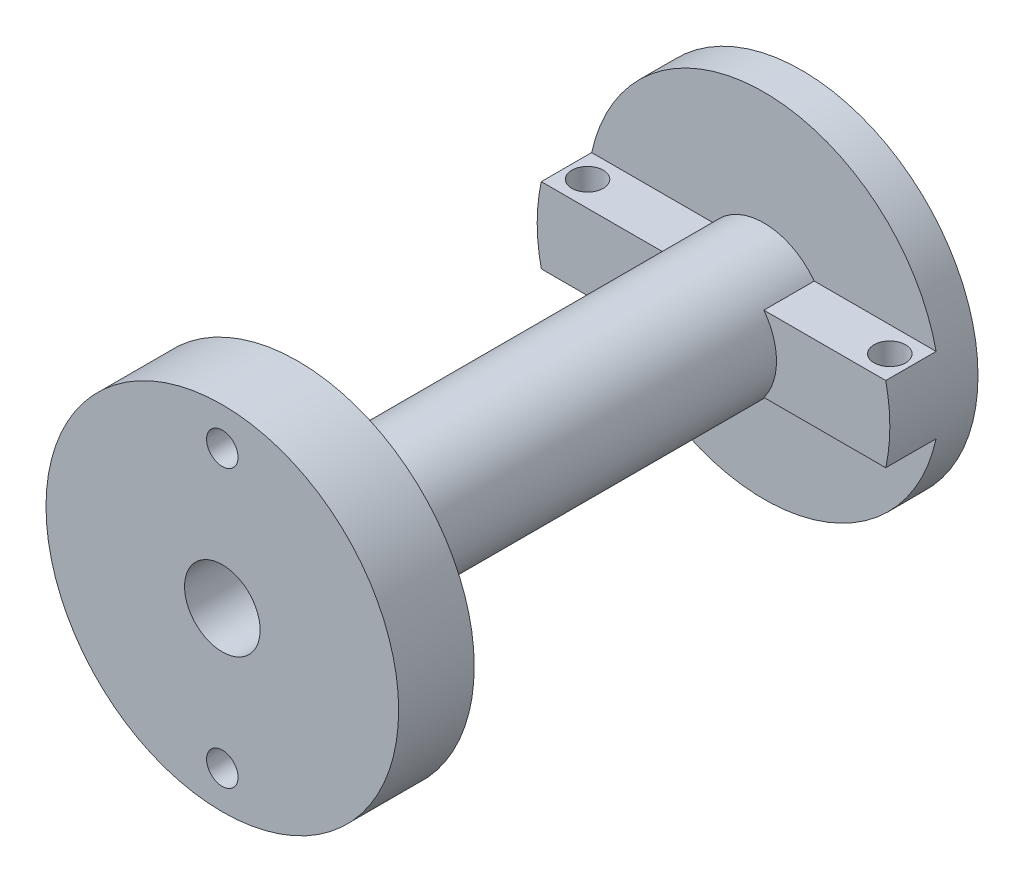
from build123d import *
from build123d.topology import SkipClean

# Parameters (mm, degrees)
SKETCH1_R           = 7
BOSS_EXTRUDE1_DEPTH = 1.5
SKETCH2_R           = 2.5
BOSS_EXTRUDE2_DEPTH = 18.5
SKETCH3_R           = 7
BOSS_EXTRUDE3_DEPTH = 3
CUT_EXTRUDE1_REACH  = 27.04
SKETCH4_R           = 1.5
CUT_EXTRUDE4_REACH  = 27.04
SKETCH5_R           = 0.625
BOSS_EXTRUDE5_DEPTH = 2
CUT_EXTRUDE5_REACH  = 27.5
SKETCH16_R          = 0.625
CUT_EXTRUDE6_REACH  = 25.67
SKETCH17_R          = 1.5


with BuildPart() as part:
    # Sketch1 → Boss-Extrude1 (new body)
    with BuildSketch(Plane.XY):
        Circle(SKETCH1_R)
    extrude(amount=BOSS_EXTRUDE1_DEPTH)

    # Sketch2 → Boss-Extrude2 (add)
    with BuildSketch(Plane.XY.offset(1.5)):
        Circle(SKETCH2_R)
    extrude(amount=BOSS_EXTRUDE2_DEPTH)

    # Sketch3 → Boss-Extrude3 (add)
    with BuildSketch(Plane.XY.offset(20)):
        Circle(SKETCH3_R)
    extrude(amount=BOSS_EXTRUDE3_DEPTH)

    # Sketch4 → Cut-Extrude1 (cut, up to next)
    with BuildSketch(Plane(origin=(0, 0, 0), x_dir=(-1, 0, 0), z_dir=(0, 0, -1)), mode=Mode.PRIVATE) as cut_extrude1_sk1:
        Circle(SKETCH4_R)
    cut_extrude1_tool1 = extrude(cut_extrude1_sk1.sketch, amount=-CUT_EXTRUDE1_REACH, mode=Mode.PRIVATE) & part.part
    add(cut_extrude1_tool1.solids().sort_by_distance((0, 0, 0))[0], mode=Mode.SUBTRACT)

    # Sketch5 → Cut-Extrude4 (cut, up to next)
    with BuildSketch(Plane.XY.offset(23), mode=Mode.PRIVATE) as cut_extrude4_sk1:
        with Locations((0, 5.5)):
            Circle(SKETCH5_R)
    cut_extrude4_tool1 = extrude(cut_extrude4_sk1.sketch, amount=-CUT_EXTRUDE4_REACH, mode=Mode.PRIVATE) & part.part
    # Sketch5 → Cut-Extrude4 (cut, up to next)
    with BuildSketch(Plane.XY.offset(23), mode=Mode.PRIVATE) as cut_extrude4_sk2:
        with Locations((0, -5.5)):
            Circle(SKETCH5_R)
    cut_extrude4_tool2 = extrude(cut_extrude4_sk2.sketch, amount=-CUT_EXTRUDE4_REACH, mode=Mode.PRIVATE) & part.part
    add(cut_extrude4_tool1.solids().sort_by_distance((0, 5.5, 23))[0], mode=Mode.SUBTRACT)
    add(cut_extrude4_tool2.solids().sort_by_distance((0, -5.5, 23))[0], mode=Mode.SUBTRACT)

    # Sketch15 → Boss-Extrude5 (add)
    with SkipClean():  # the faces are left unmerged after this step: merging them gives an invalid solid
        with BuildSketch(Plane.XY.offset(1.5)):
            with BuildLine():
                Line((6.837397, -1.5), (-6.837397, -1.5))
                ThreePointArc((-6.837397, -1.5), (-7, 0), (-6.837397, 1.5))
                Line((-6.837397, 1.5), (6.837397, 1.5))
                ThreePointArc((6.837397, 1.5), (7, 0), (6.837397, -1.5))
            make_face()
        extrude(amount=BOSS_EXTRUDE5_DEPTH)

    # Sketch16 → Cut-Extrude5 (cut, up to next)
    with BuildSketch(Plane.XZ.offset(1.5), mode=Mode.PRIVATE) as cut_extrude5_sk1:
        with Locations((-6, 2.5)):
            Circle(SKETCH16_R)
    cut_extrude5_tool1 = extrude(cut_extrude5_sk1.sketch, amount=-CUT_EXTRUDE5_REACH, mode=Mode.PRIVATE) & part.part
    # Sketch16 → Cut-Extrude5 (cut, up to next)
    with BuildSketch(Plane.XZ.offset(1.5), mode=Mode.PRIVATE) as cut_extrude5_sk2:
        with Locations(Location((6, 2.5, 0), (0, 0, 270))):
            Circle(SKETCH16_R)
    cut_extrude5_tool2 = extrude(cut_extrude5_sk2.sketch, amount=-CUT_EXTRUDE5_REACH, mode=Mode.PRIVATE) & part.part
    add(cut_extrude5_tool1.solids().sort_by_distance((-6, -1.5, 2.5))[0], mode=Mode.SUBTRACT)
    add(cut_extrude5_tool2.solids().sort_by_distance((6, -1.5, 2.5))[0], mode=Mode.SUBTRACT)

    # Sketch17 → Cut-Extrude6 (cut, up to next)
    with BuildSketch(Plane(origin=(0, 0, 1.5), x_dir=(-1, 0, 0), z_dir=(0, 0, -1)), mode=Mode.PRIVATE) as cut_extrude6_sk1:
        Circle(SKETCH17_R)
    cut_extrude6_tool1 = extrude(cut_extrude6_sk1.sketch, amount=-CUT_EXTRUDE6_REACH, mode=Mode.PRIVATE) & part.part
    add(cut_extrude6_tool1.solids().sort_by_distance((0, 0, 1.5))[0], mode=Mode.SUBTRACT)


solid = part.part
